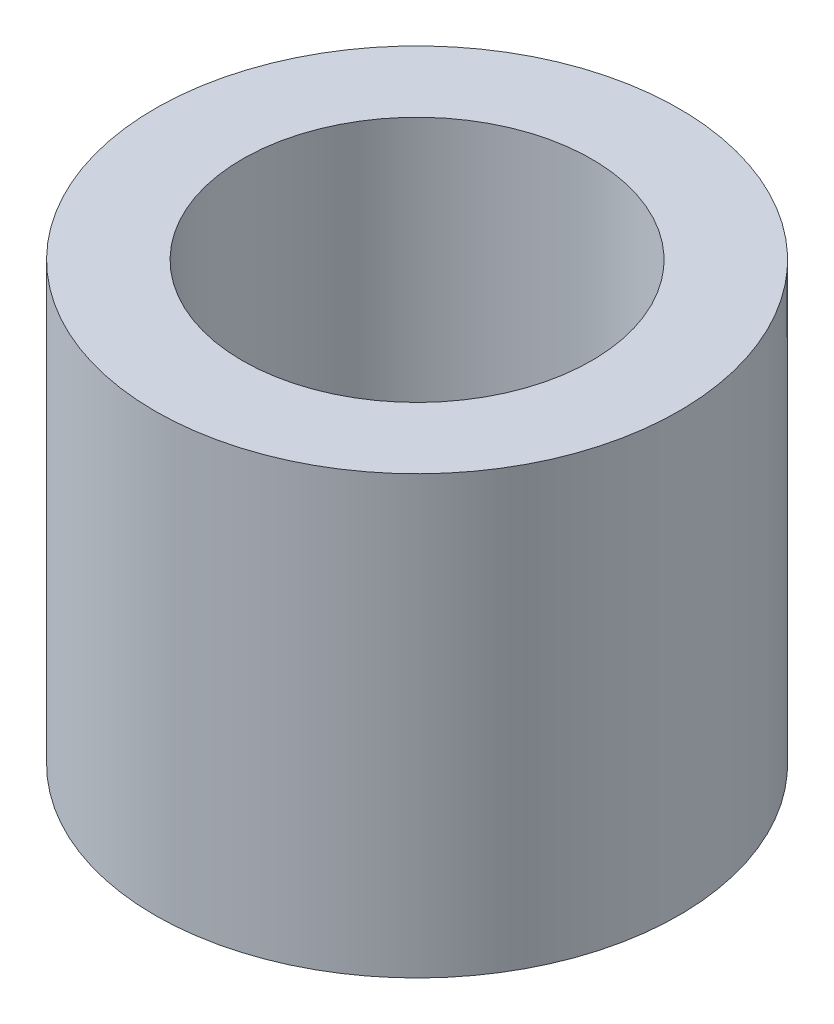
from build123d import *

# Parameters (mm, degrees)
SKETCH_1_R      = 1.5
SKETCH_1_R_2    = 1
EXTRUDE_1_DEPTH = 2.5


with BuildPart() as part:
    # Эскиз1 → Бобышка-Вытянуть1 (new body)
    with BuildSketch(Plane(origin=(0, 0, 0), x_dir=(1, 0, 0), z_dir=(0, 1, 0))):
        with Locations(Location((0, 0, 0), (0, 0, 270))):
            Circle(SKETCH_1_R)
        with Locations(Location((0, 0, 0), (0, 0, 270))):
            Circle(SKETCH_1_R_2, mode=Mode.SUBTRACT)
    extrude(amount=EXTRUDE_1_DEPTH)


solid = part.part
